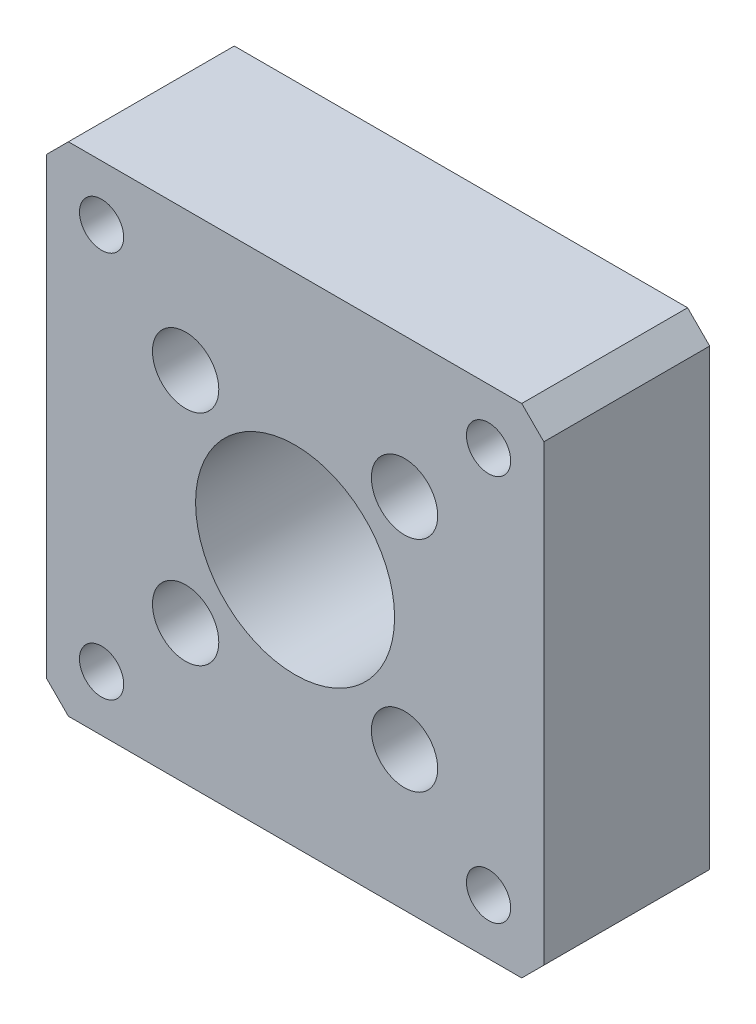
from build123d import *

# Parameters (mm, degrees)
SKETCH1_W           = 45
SKETCH1_H           = 45
SKETCH1_R           = 9
SKETCH1_R_2         = 2
BOSS_EXTRUDE1_DEPTH = 15
SKETCH2_R           = 1.65
CUT_EXTRUDE1_DEPTH  = 15
SKETCH3_R           = 3
CUT_EXTRUDE2_DEPTH  = 8
CHAMFER1_SIZE       = 2
SKETCH4_R           = 11.2
CUT_EXTRUDE3_DEPTH  = 2


with BuildPart() as part:
    # Sketch1 → Boss-Extrude1 (new body)
    with BuildSketch(Plane.XY):
        Rectangle(SKETCH1_W, SKETCH1_H)
        Circle(SKETCH1_R, mode=Mode.SUBTRACT)
        with Locations((-17.5, 17.5)):
            Circle(SKETCH1_R_2, mode=Mode.SUBTRACT)
        with Locations((17.5, 17.5)):
            Circle(SKETCH1_R_2, mode=Mode.SUBTRACT)
        with Locations((17.5, -17.5)):
            Circle(SKETCH1_R_2, mode=Mode.SUBTRACT)
        with Locations((-17.5, -17.5)):
            Circle(SKETCH1_R_2, mode=Mode.SUBTRACT)
    extrude(amount=BOSS_EXTRUDE1_DEPTH)

    # Sketch2 → Cut-Extrude1 (cut)
    with BuildSketch(Plane.XY.offset(15)):
        with Locations((9.899494937, 9.899494937)):
            Circle(SKETCH2_R)
        with Locations((9.899494937, -9.899494937)):
            Circle(SKETCH2_R)
        with Locations((-9.899494937, -9.899494937)):
            Circle(SKETCH2_R)
        with Locations((-9.899494937, 9.899494937)):
            Circle(SKETCH2_R)
    extrude(amount=-CUT_EXTRUDE1_DEPTH, mode=Mode.SUBTRACT)

    # Sketch3 → Cut-Extrude2 (cut)
    with BuildSketch(Plane.XY.offset(15)):
        with Locations((9.899494937, 9.899494937)):
            Circle(SKETCH3_R)
        with Locations((9.899494937, -9.899494937)):
            Circle(SKETCH3_R)
        with Locations((-9.899494937, -9.899494937)):
            Circle(SKETCH3_R)
        with Locations((-9.899494937, 9.899494937)):
            Circle(SKETCH3_R)
    extrude(amount=-CUT_EXTRUDE2_DEPTH, mode=Mode.SUBTRACT)

    # Chamfer1
    chamfer1_edges = [part.edges().sort_by_distance(p)[0] for p in [
        (22.5, -22.5, 7.5),
        (-22.5, -22.5, 7.5),
        (-22.5, 22.5, 7.5),
        (22.5, 22.5, 7.5),
    ]]
    chamfer(chamfer1_edges, length=CHAMFER1_SIZE)

    # Sketch4 → Cut-Extrude3 (cut)
    with BuildSketch(Plane(origin=(0, 0, 0), x_dir=(-1, 0, 0), z_dir=(0, 0, -1))):
        Circle(SKETCH4_R)
    extrude(amount=-CUT_EXTRUDE3_DEPTH, mode=Mode.SUBTRACT)


solid = part.part
